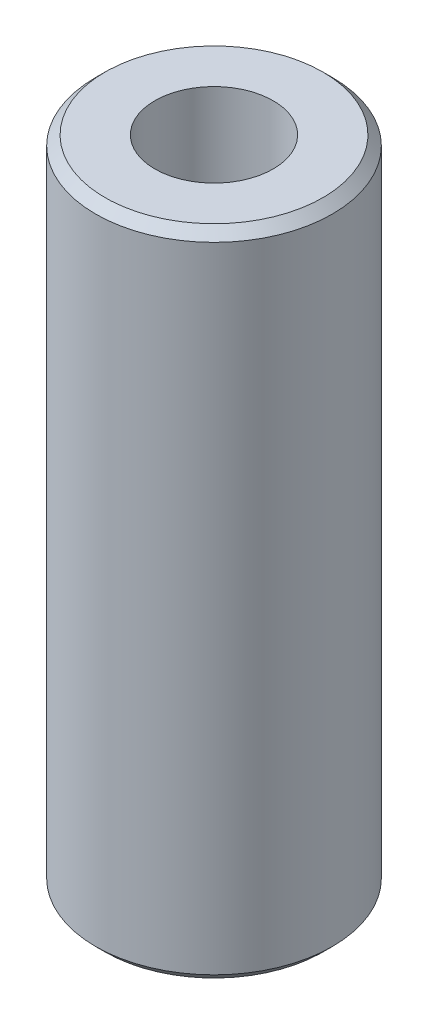
from build123d import *

# Parameters (mm, degrees)
SKETCH_1_R             = 2.5
EXTRUDE_1_DEPTH        = 6.9
HOLE_WIZARD_M3_1_D     = 2.5
HOLE_WIZARD_M3_1_DEPTH = 6.5
HOLE_WIZARD_M3_1_TIP   = 0.751075774
HOLE_WIZARD_M3_2_D     = 2.5
HOLE_WIZARD_M3_2_DEPTH = 6.5
HOLE_WIZARD_M3_2_TIP   = 0.751075774
CHAMFER_1_SIZE         = 0.2


with BuildPart() as part:
    # 草图1 → 凸台-拉伸1 (new, symmetric)
    with BuildSketch(Plane(origin=(0, 0, 0), x_dir=(1, 0, 0), z_dir=(0, 1, 0))):
        with Locations(Location((0, 0, 0), (0, 0, 90))):
            Circle(SKETCH_1_R)
    extrude(amount=EXTRUDE_1_DEPTH, both=True)

    # M3 螺纹孔1
    with Locations(Plane(origin=(0, 6.9, 0), x_dir=(1, 0, 0), z_dir=(0, 1, 0))):
        with Locations((0, 0)):
            Hole(HOLE_WIZARD_M3_1_D / 2, depth=HOLE_WIZARD_M3_1_DEPTH)
            with Locations((0, 0, -(HOLE_WIZARD_M3_1_DEPTH + HOLE_WIZARD_M3_1_TIP / 2))):  # 118° drill point
                Cone(0, HOLE_WIZARD_M3_1_D / 2, HOLE_WIZARD_M3_1_TIP, mode=Mode.SUBTRACT)

    # M3 螺纹孔2
    with Locations(Plane(origin=(0, -6.9, 0), x_dir=(-1, 0, 0), z_dir=(0, -1, 0))):
        with Locations((0, 0)):
            Hole(HOLE_WIZARD_M3_2_D / 2, depth=HOLE_WIZARD_M3_2_DEPTH)
            with Locations((0, 0, -(HOLE_WIZARD_M3_2_DEPTH + HOLE_WIZARD_M3_2_TIP / 2))):  # 118° drill point
                Cone(0, HOLE_WIZARD_M3_2_D / 2, HOLE_WIZARD_M3_2_TIP, mode=Mode.SUBTRACT)

    # 倒角1
    chamfer_1_edges = [part.edges().sort_by_distance(p)[0] for p in [
        (0, -6.9, 2.5),
        (0, 6.9, 2.5),
    ]]
    chamfer(chamfer_1_edges, length=CHAMFER_1_SIZE)


solid = part.part
